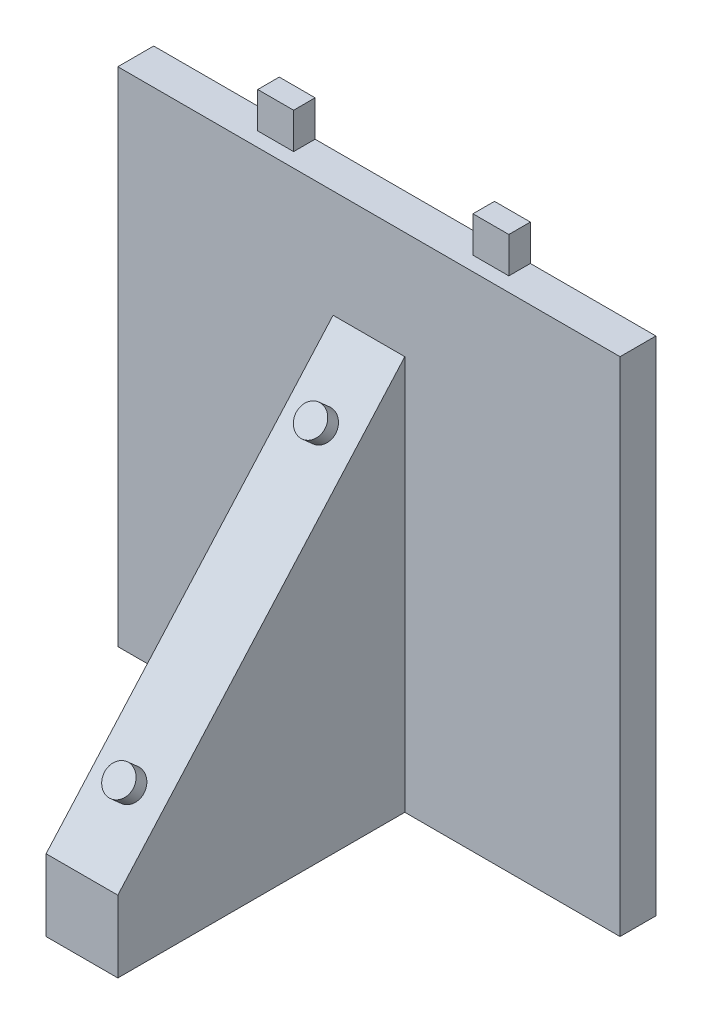
from build123d import *

# Parameters (mm, degrees)
SKETCH1_W                = 70
SKETCH1_H                = 70
BOSS_EXTRUDE1_DEPTH      = 5
SKETCH2_W                = 5
SKETCH2_H                = 3
BOSS_EXTRUDE2_DEPTH      = 5
BOSS_EXTRUDE6_DEPTH      = 5
BOSS_EXTRUDE6_DEPTH_BACK = 5
SKETCH16_R               = 2
BOSS_EXTRUDE10_DEPTH     = 2


with BuildPart() as part:
    # Sketch1 → Boss-Extrude1 (new body)
    with BuildSketch(Plane(origin=(0, 0, 0), x_dir=(0, 1, 0), z_dir=(0, 0, 1))):
        Rectangle(SKETCH1_W, SKETCH1_H)
    extrude(amount=BOSS_EXTRUDE1_DEPTH)

    # Sketch2 → Boss-Extrude2 (add)
    with BuildSketch(Plane(origin=(0, 35, 0), x_dir=(-1, 0, 0), z_dir=(0, 1, 0))):
        with Locations((-15, 1.5)):
            Rectangle(SKETCH2_W, SKETCH2_H)
        with Locations((15, 1.5)):
            Rectangle(SKETCH2_W, SKETCH2_H)
    extrude(amount=BOSS_EXTRUDE2_DEPTH)

    # Sketch10 → Boss-Extrude6 (add, two sides: drawn at the far end of the back side and taken through both)
    with BuildSketch(Plane.YZ.offset(-BOSS_EXTRUDE6_DEPTH_BACK)):
        Polygon((20, 5), (-25, 45), (-35, 45), (-35, 5), align=None)
    extrude(amount=BOSS_EXTRUDE6_DEPTH + BOSS_EXTRUDE6_DEPTH_BACK)

    # Sketch16 → Boss-Extrude10 (add)
    with BuildSketch(Plane(origin=(0, 11.310344828, 12.724137931), x_dir=(1, 0, 0), z_dir=(0, 0.6643638388299197, 0.7474093186836598))):
        with Locations(Location((0, 1.62636718, 0), (0, 0, 270))):
            Circle(SKETCH16_R)
        with Locations(Location((0, -38.581605714, 0), (0, 0, 270))):
            Circle(SKETCH16_R)
    extrude(amount=BOSS_EXTRUDE10_DEPTH)


solid = part.part
